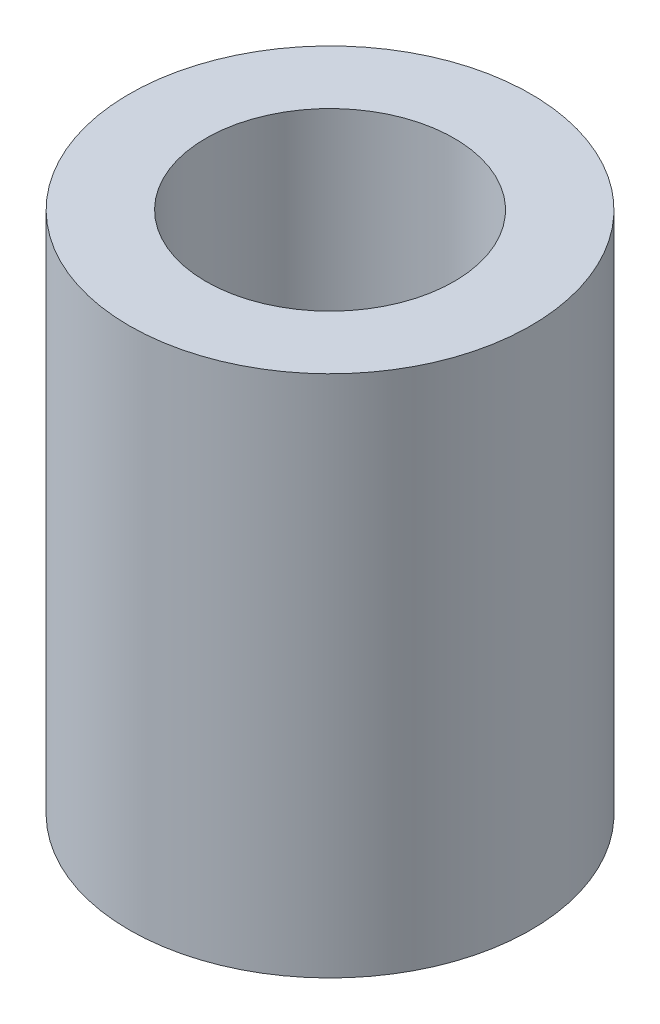
from build123d import *

# Parameters (mm, degrees)
SKETCH1_R           = 5.2375
SKETCH1_R_2         = 3.2375
BOSS_EXTRUDE1_DEPTH = 13.65


with BuildPart() as part:
    # Sketch1 → Boss-Extrude1 (new body)
    with BuildSketch(Plane(origin=(0, 0, 0), x_dir=(1, 0, 0), z_dir=(0, 1, 0))):
        with Locations(Location((0, 0, 0), (0, 0, 270))):
            Circle(SKETCH1_R)
        with Locations(Location((0, 0, 0), (0, 0, 270))):
            Circle(SKETCH1_R_2, mode=Mode.SUBTRACT)
    extrude(amount=BOSS_EXTRUDE1_DEPTH)


solid = part.part
